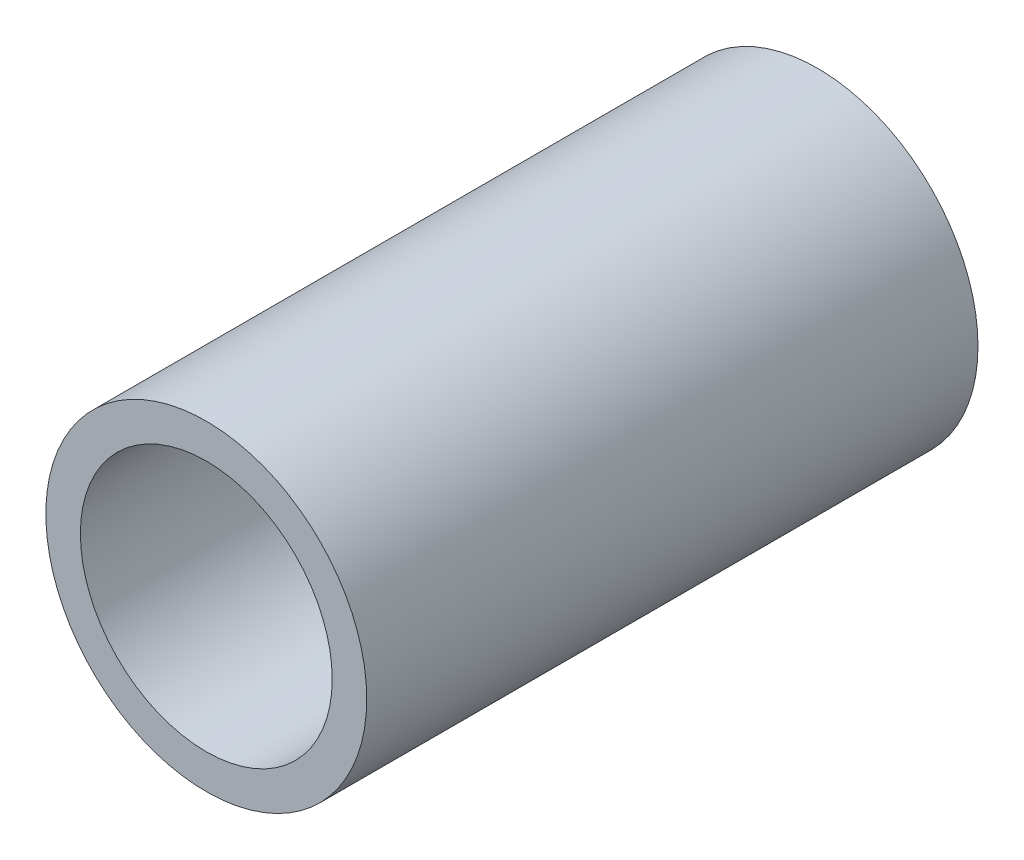
from build123d import *

# Parameters (mm, degrees)
SKETCH1_R           = 13.335
SKETCH1_R_2         = 10.4648
BOSS_EXTRUDE1_DEPTH = 50.8


with BuildPart() as part:
    # Sketch1 → Boss-Extrude1 (new body)
    with BuildSketch(Plane.XY):
        Circle(SKETCH1_R)
        Circle(SKETCH1_R_2, mode=Mode.SUBTRACT)
    extrude(amount=BOSS_EXTRUDE1_DEPTH)


solid = part.part
